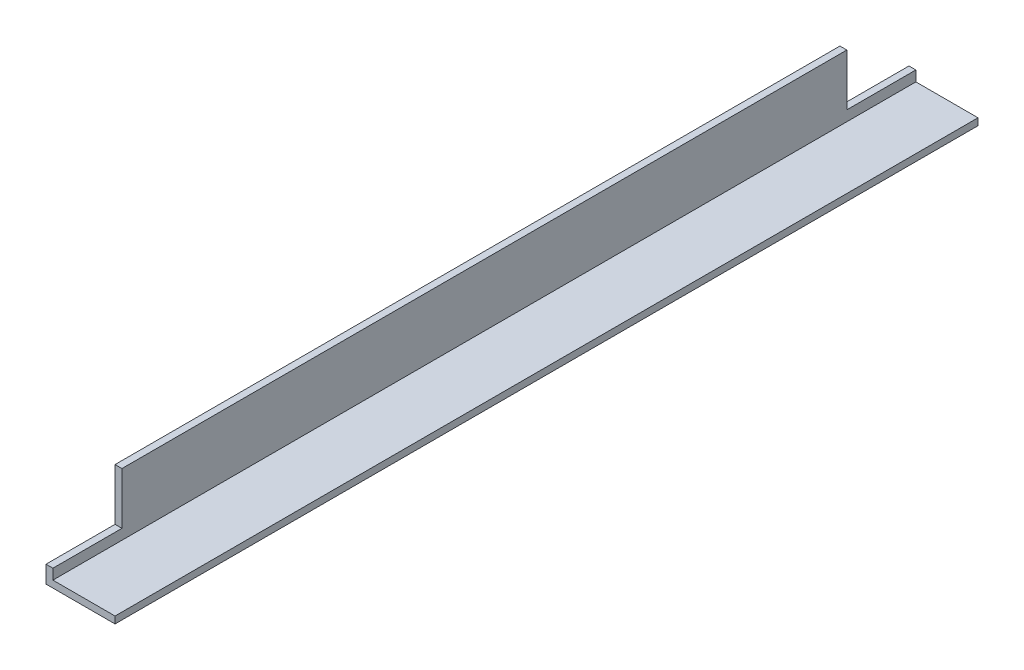
from build123d import *

# Parameters (mm, degrees)
EXTRUDE_1_DEPTH     = 500
SKETCH_2_W          = 40
SKETCH_2_H          = 30
CUT_EXTRUDE_1_DEPTH = 504.189825016
SKETCH_3_W          = 40
SKETCH_3_H          = 30
CUT_EXTRUDE_2_DEPTH = 504.189825016


with BuildPart() as part:
    # Эскиз1 → Бобышка-Вытянуть1 (new body)
    with BuildSketch(Plane.XY):
        Polygon((0, 0), (0, 40), (4, 40), (4, 4), (40, 4), (40, 0), align=None)
    extrude(amount=EXTRUDE_1_DEPTH)

    # Эскиз2 → Вырез-Вытянуть1 (cut, through all)
    with BuildSketch(Plane.ZY):
        with Locations((20, 25)):
            Rectangle(SKETCH_2_W, SKETCH_2_H)
    extrude(amount=-CUT_EXTRUDE_1_DEPTH, mode=Mode.SUBTRACT)

    # Эскиз3 → Вырез-Вытянуть2 (cut, through all)
    with BuildSketch(Plane.ZY):
        with Locations((480, 25)):
            Rectangle(SKETCH_3_W, SKETCH_3_H)
    extrude(amount=-CUT_EXTRUDE_2_DEPTH, mode=Mode.SUBTRACT)


solid = part.part
